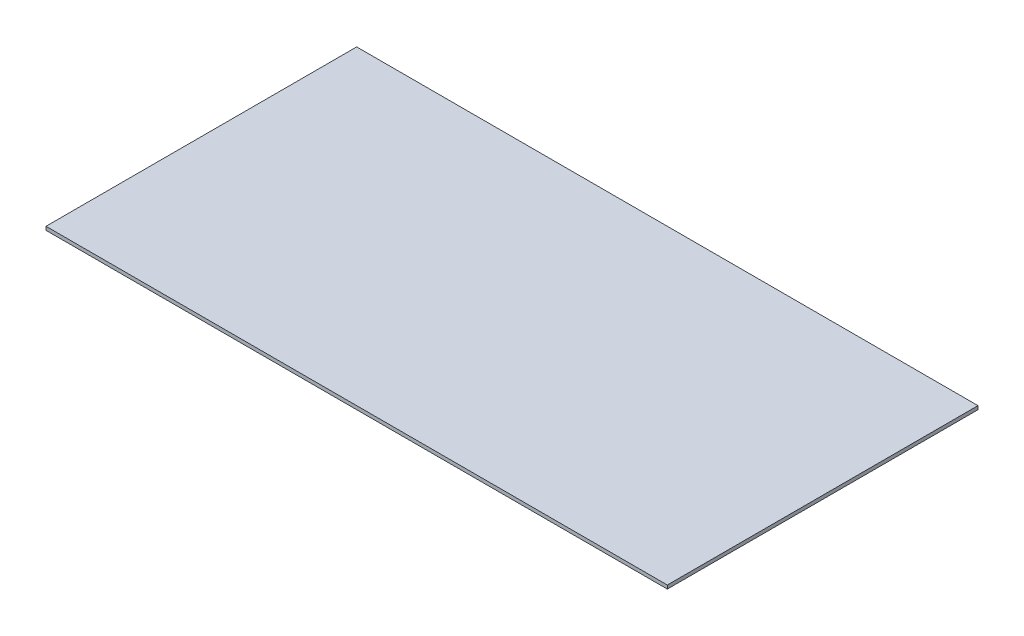
from build123d import *

# Parameters (mm, degrees)
SKETCH_1_W      = 280
SKETCH_1_H      = 140
EXTRUDE_1_DEPTH = 1.6


with BuildPart() as part:
    # Эскиз1 → Бобышка-Вытянуть1 (new body)
    with BuildSketch(Plane(origin=(0, 0, 0), x_dir=(1, 0, 0), z_dir=(0, 1, 0))):
        Rectangle(SKETCH_1_W, SKETCH_1_H)
    extrude(amount=EXTRUDE_1_DEPTH)


solid = part.part
